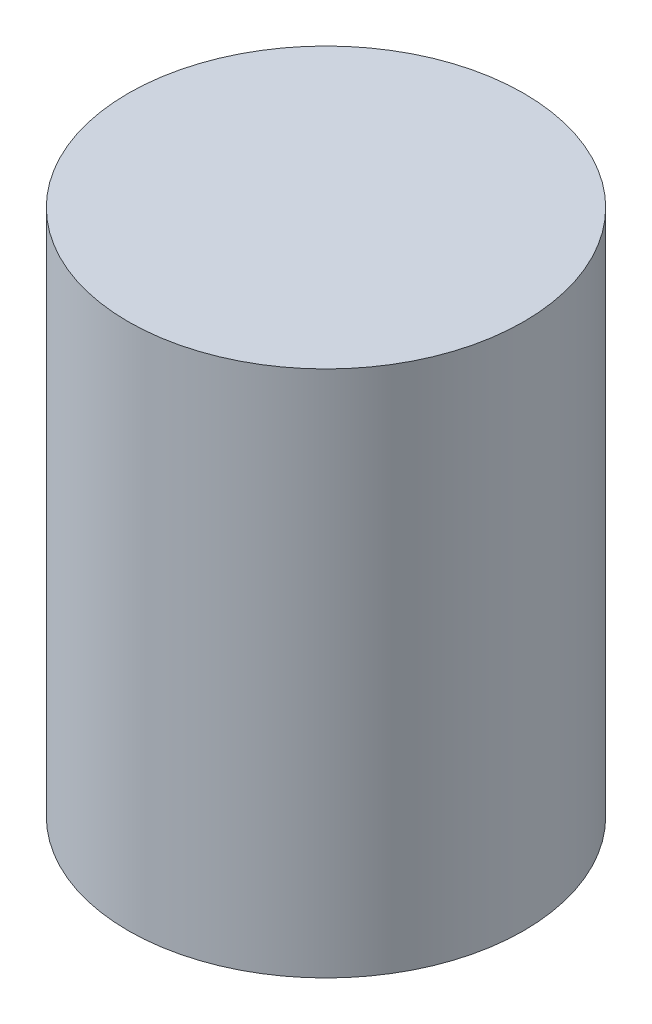
from build123d import *

# Parameters (mm, degrees)
SKETCH_1_R          = 1.5
EXTRUDE_1_DEPTH     = 4
CUT_EXTRUDE_1_DEPTH = 2


with BuildPart() as part:
    # 草图1 → 凸台-拉伸1 (new body)
    with BuildSketch(Plane(origin=(0, 0, 0), x_dir=(1, 0, 0), z_dir=(0, 1, 0))):
        with Locations(Location((0, 0, 0), (0, 0, 270))):
            Circle(SKETCH_1_R)
    extrude(amount=EXTRUDE_1_DEPTH)

    # 草图2 → 切除-拉伸1 (cut)
    with BuildSketch(Plane.XZ):
        Polygon((0.694435065, -0.517455255), (0.795346928, 0.34267078), (0.100911863, 0.860126035), (-0.694435065, 0.517455255), (-0.795346928, -0.34267078), (-0.100911863, -0.860126035), align=None)
    extrude(amount=-CUT_EXTRUDE_1_DEPTH, mode=Mode.SUBTRACT)


solid = part.part
